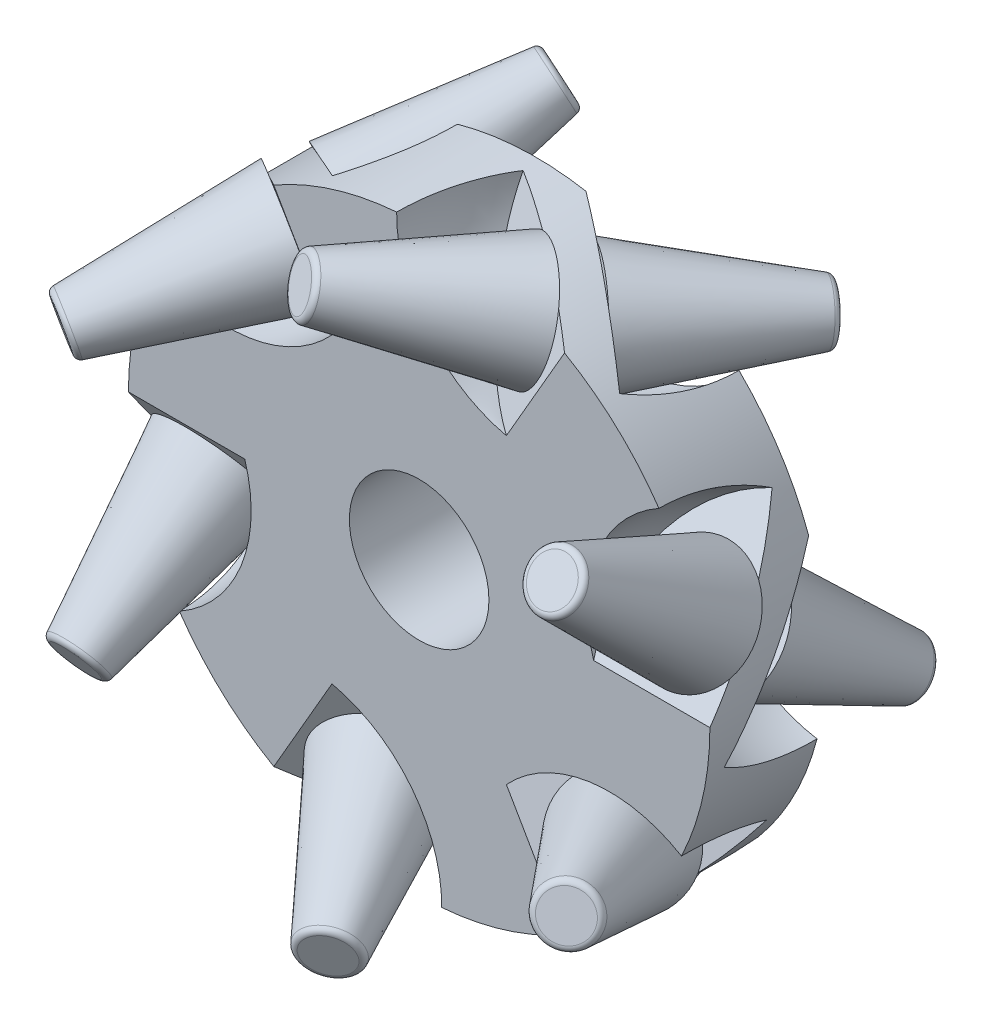
from build123d import *

# Parameters (mm, degrees)
SKETCH1_R                = 25
BOSS_EXTRUDE2_DEPTH      = 10
CUT_REVOLVE8_ANGLE       = 35
CIRPATTERN3_COUNT        = 6
CUT_REVOLVE9_ANGLE       = 35
CIRPATTERN4_COUNT        = 6
SKETCH9_R                = 6
CUT_EXTRUDE1_DEPTH       = 37.742346305
BOSS_EXTRUDE3_DEPTH      = 5
BOSS_EXTRUDE3_DEPTH_BACK = 1
SKETCH10_R               = 6.5
SKETCH11_R               = 1.5
CUT_EXTRUDE2_DEPTH       = 39.405728909
SKETCH12_R               = 1
CUT_EXTRUDE3_DEPTH       = 5
CIRPATTERN5_COUNT        = 6
SKETCH14_R               = 5
BOSS_EXTRUDE4_DEPTH      = 15
BOSS_EXTRUDE4_TAPER      = 10
SKETCH15_R               = 5
BOSS_EXTRUDE5_DEPTH      = 15
BOSS_EXTRUDE5_TAPER      = 10
FILLET1_R                = 0.5
FILLET2_R                = 0.5
CIRPATTERN13_COUNT       = 6
CIRPATTERN14_COUNT       = 6
FILLET3_R                = 0.5
FILLET4_R                = 0.5


with BuildPart() as part:
    # Sketch1 → Boss-Extrude2 (new body)
    with BuildSketch(Plane.XY):
        Circle(SKETCH1_R)
    extrude(amount=-BOSS_EXTRUDE2_DEPTH)

    # Sketch3 → Cut-Revolve8 (revolve, cut)
    with BuildSketch(Plane.XY):
        with BuildLine():
            Line((28.02287637, 0), (15, 0))
            ThreePointArc((15, 0), (15.961316581, 9.465252983), (23.485058755, 15.288349007))
            ThreePointArc((23.485058755, 15.288349007), (26.864479318, 7.973791508), (28.02287637, 0))
        make_face()
    cut_revolve8 = revolve(axis=Axis((28.02287637, 0, 0), (-1, 0, 0)), revolution_arc=CUT_REVOLVE8_ANGLE, mode=Mode.SUBTRACT)

    # CirPattern3: Cut-Revolve8 ×6 about axis
    cirpattern3_axis = Axis((0, 0, 0), (0, 0, 1))
    for i in range(1, CIRPATTERN3_COUNT):
        add(cut_revolve8.rotate(cirpattern3_axis, i * 360 / CIRPATTERN3_COUNT), mode=Mode.SUBTRACT)

    # Sketch8 → Cut-Revolve9 (revolve, cut)
    with BuildSketch(Plane(origin=(0, 0, -10), x_dir=(-1, 0, 0), z_dir=(0, 0, -1))):
        with BuildLine():
            Line((21.466768724, 18.012757719), (11.490666647, 9.641814145))
            ThreePointArc((11.490666647, 9.641814145), (6.142930532, 17.510540983), (8.163437441, 26.807459581))
            ThreePointArc((8.163437441, 26.807459581), (15.453930715, 23.376433122), (21.466768724, 18.012757719))
        make_face()
    cut_revolve9 = revolve(axis=Axis((-21.466768724, 18.012757719, -10), (0.7660444431189771, -0.6427876096865406, 0)), revolution_arc=CUT_REVOLVE9_ANGLE, mode=Mode.SUBTRACT)

    # CirPattern4: Cut-Revolve9 ×6 about axis
    cirpattern4_axis = Axis((0, 0, 0), (0, 0, 1))
    for i in range(1, CIRPATTERN4_COUNT):
        add(cut_revolve9.rotate(cirpattern4_axis, i * 360 / CIRPATTERN4_COUNT), mode=Mode.SUBTRACT)

    # Sketch9 → Cut-Extrude1 (cut, through all)
    with BuildSketch(Plane.XY):
        Circle(SKETCH9_R)
    extrude(amount=-CUT_EXTRUDE1_DEPTH, mode=Mode.SUBTRACT)

    # Sketch10 → Boss-Extrude3 (add, two sides: drawn at the far end of the back side and taken through both)
    with BuildSketch(Plane(origin=(0, 0, -10), x_dir=(-1, 0, 0), z_dir=(0, 0, -1)).offset(-BOSS_EXTRUDE3_DEPTH_BACK)):
        Circle(SKETCH10_R)
    extrude(amount=BOSS_EXTRUDE3_DEPTH + BOSS_EXTRUDE3_DEPTH_BACK)

    # Sketch11 → Cut-Extrude2 (cut, through all)
    with BuildSketch(Plane(origin=(0, 0, -15), x_dir=(-1, 0, 0), z_dir=(0, 0, -1))):
        Circle(SKETCH11_R)
    extrude(amount=-CUT_EXTRUDE2_DEPTH, mode=Mode.SUBTRACT)

    # Sketch12 → Cut-Extrude3 (cut)
    with BuildSketch(Plane(origin=(0, 0, 0), x_dir=(0.8679041155260897, 0.16413888955723188, 0.46882925590005015), z_dir=(-0.49673176489215576, 0.2867882181755224, 0.819152044288991))):
        with Locations(Location((7.18837247, 20.010487095, 0), (0, 0, 350.134492279))):
            Circle(SKETCH12_R)
    cut_extrude3 = extrude(amount=-CUT_EXTRUDE3_DEPTH, mode=Mode.SUBTRACT)

    # CirPattern5: Cut-Extrude3 ×6 about axis
    cirpattern5_axis = Axis((0, 0, -10), (0, 0, 1))
    for i in range(1, CIRPATTERN5_COUNT):
        add(cut_extrude3.rotate(cirpattern5_axis, i * 360 / CIRPATTERN5_COUNT), mode=Mode.SUBTRACT)

    # Sketch14 → Boss-Extrude4 (add)
    with BuildSketch(Plane(origin=(-3.020113868, -3.599231552, -6.710100717), x_dir=(-0.9295532725964002, 0.17427286936681358, 0.32489949277889), z_dir=(-0.3686878264946139, -0.43938504177070553, -0.8191520442889909))):
        with Locations((-16.401757838, -11.520144949)):
            Circle(SKETCH14_R)
    boss_extrude4 = extrude(amount=BOSS_EXTRUDE4_DEPTH, taper=BOSS_EXTRUDE4_TAPER)

    # Sketch15 → Boss-Extrude5 (add)
    with BuildSketch(Plane(origin=(0, 0, 0), x_dir=(0.867904115526092, -0.16413888955723419, -0.4688292559000452), z_dir=(0.4967317648921518, 0.2867882181755295, 0.819152044288991))):
        with Locations((16.428722849, -13.497753817)):
            Circle(SKETCH15_R)
    boss_extrude5 = extrude(amount=BOSS_EXTRUDE5_DEPTH, taper=BOSS_EXTRUDE5_TAPER)

    # Fillet1
    fillet1_edges = [part.edges().sort_by_distance(p)[0] for p in [
        (19.665535753, -10.747761808, 10.149318718),
    ]]
    fillet(fillet1_edges, radius=FILLET1_R)

    # Fillet2
    fillet2_edges = [part.edges().sort_by_distance(p)[0] for p in [
        (8.885062943, -23.610737606, -19.646084229),
    ]]
    fillet(fillet2_edges, radius=FILLET2_R)

    # CirPattern13: Boss-Extrude4 ×6 about axis
    cirpattern13_axis = Axis((0, 0, 0), (0, 0, 1))
    for i in range(1, CIRPATTERN13_COUNT):
        add(boss_extrude4.rotate(cirpattern13_axis, i * 360 / CIRPATTERN13_COUNT))

    # CirPattern14: Boss-Extrude5 ×6 about axis
    cirpattern14_axis = Axis((0, 0, 0), (0, 0, 1))
    for i in range(1, CIRPATTERN14_COUNT):
        add(boss_extrude5.rotate(cirpattern14_axis, i * 360 / CIRPATTERN14_COUNT))

    # Fillet3
    fillet3_edges = [part.edges().sort_by_distance(p)[0] for p in [
        (19.140602636, 11.656972637, 10.149318718),
        (-0.524933117, 22.404734445, 10.149318718),
        (-19.665535753, 10.747761808, 10.149318718),
        (-19.140602636, -11.656972637, 10.149318718),
        (0.524933117, -22.404734445, 10.149318718),
    ]]
    fillet(fillet3_edges, radius=FILLET3_R)

    # Fillet4
    fillet4_edges = [part.edges().sort_by_distance(p)[0] for p in [
        (24.890030041, -4.11067858, -19.646084229),
        (16.004967097, 19.500059026, -19.646084229),
        (-8.885062943, 23.610737606, -19.646084229),
        (-24.890030041, 4.11067858, -19.646084229),
        (-16.004967097, -19.500059026, -19.646084229),
    ]]
    fillet(fillet4_edges, radius=FILLET4_R)


solid = part.part
